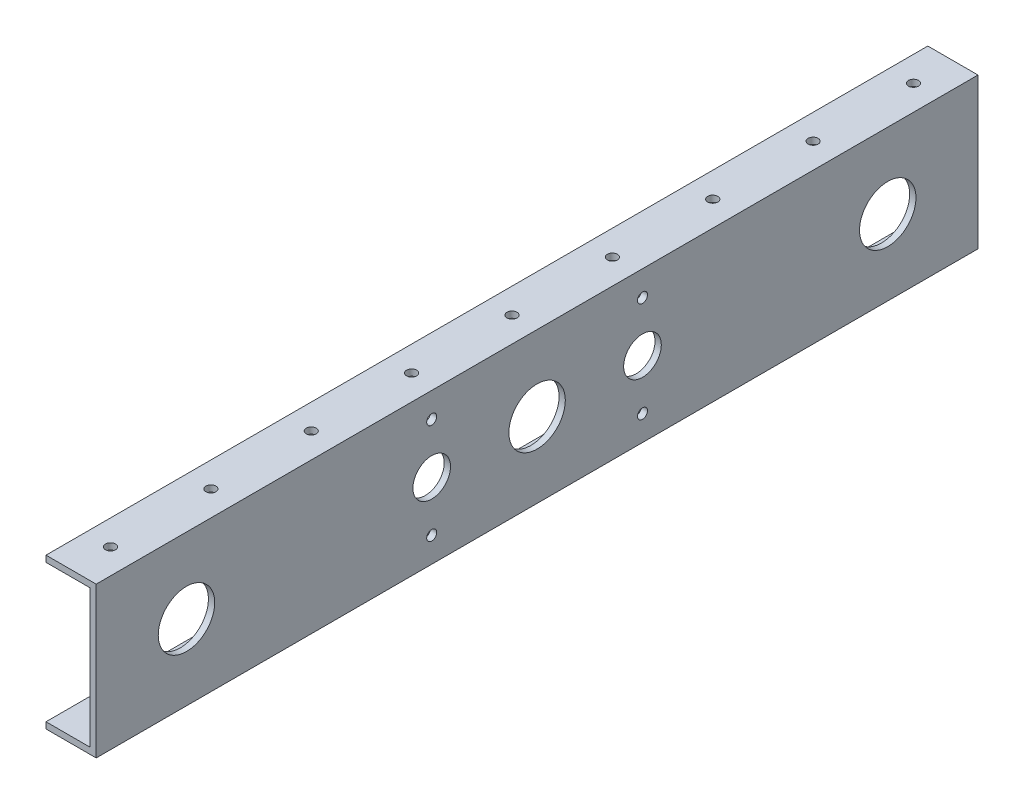
from build123d import *

# Parameters (mm, degrees)
BOSS_EXTRUDE1_START = -317.5
SKETCH4_R           = 2.54
SKETCH4_R_2         = 9.525
SKETCH4_R_3         = 14.2875
BOSS_EXTRUDE1_DEPTH = 3.175
BOSS_EXTRUDE2_DEPTH = 3.175
BOSS_EXTRUDE3_START = -76.2
BOSS_EXTRUDE3_DEPTH = 3.175
SKETCH9_R           = 2.54
CUT_EXTRUDE2_DEPTH  = 506.024067921
LPATTERN1_COUNT     = 10
LPATTERN1_PITCH     = 50.8
SKETCH13_W          = 25.4
SKETCH13_H          = 139.7
CUT_EXTRUDE4_DEPTH  = 506.024067921


with BuildPart() as part:
    # Sketch4 → Boss-Extrude1 (new body)
    with BuildSketch(Plane(origin=(0, 0, 0), x_dir=(0, 0, -1), z_dir=(1, 0, 0)).offset(BOSS_EXTRUDE1_START)):
        with BuildLine():
            Line((362.853219884, 88.9), (0, 88.9))
            Line((0, 88.9), (0, 65.0875))
            ThreePointArc((0, 65.0875), (14.2875, 50.8), (0, 36.5125))
            Line((0, 36.5125), (0, 12.7))
            Line((0, 12.7), (362.853219884, 12.7))
            Line((362.853219884, 12.7), (362.853219884, 88.9))
        make_face()
        with Locations((53.34, 25.4)):
            Circle(SKETCH4_R, mode=Mode.SUBTRACT)
        with Locations((53.34, 50.8)):
            Circle(SKETCH4_R_2, mode=Mode.SUBTRACT)
        with Locations((177.45964, 50.8)):
            Circle(SKETCH4_R_3, mode=Mode.SUBTRACT)
        with Locations((53.34, 76.2)):
            Circle(SKETCH4_R, mode=Mode.SUBTRACT)
        with Locations((337.453219884, 53.975)):
            Circle(SKETCH4_R_3, mode=Mode.SUBTRACT)
    extrude(amount=-BOSS_EXTRUDE1_DEPTH)

    # Sketch7 → Boss-Extrude2 (add)
    with BuildSketch(Plane(origin=(0, 88.9, 0), x_dir=(1, 0, 0), z_dir=(0, 1, 0))):
        Polygon((-319.0875, 0), (-342.9, 0), (-342.9, 362.853219884), (-317.5, 362.853219884), align=None)
    extrude(amount=-BOSS_EXTRUDE2_DEPTH)

    # Sketch7<2> → Boss-Extrude3 (add)
    with BuildSketch(Plane(origin=(0, 88.9, 0), x_dir=(1, 0, 0), z_dir=(0, 1, 0)).offset(BOSS_EXTRUDE3_START)):
        Polygon((-319.0875, 0), (-342.9, 0), (-342.9, 362.853219884), (-317.5, 362.853219884), align=None)
    extrude(amount=BOSS_EXTRUDE3_DEPTH)

    # Sketch9 → Cut-Extrude2 (cut, through all)
    with BuildSketch(Plane(origin=(0, 88.9, 0), x_dir=(1, 0, 0), z_dir=(0, 1, 0))):
        with Locations(Location((-330.2, 355.6, 0), (0, 0, 270))):
            Circle(SKETCH9_R)
    cut_extrude2 = extrude(amount=-CUT_EXTRUDE2_DEPTH, mode=Mode.SUBTRACT)

    # LPattern1: Cut-Extrude2 ×10
    with Locations(*[(0, 0, i * LPATTERN1_PITCH) for i in range(1, LPATTERN1_COUNT)]):
        add(cut_extrude2, mode=Mode.SUBTRACT)

    # Mirror1: part across face


with BuildPart() as part_1:
    add(part.part)
    add(part.part.mirror(Plane(origin=(-320.239664948, 22.265914948, 0), x_dir=(1, 0, 0), z_dir=(0, 0, 1))))

    # Sketch13 → Cut-Extrude4 (cut, through all)
    with BuildSketch(Plane(origin=(0, 88.9, 0), x_dir=(1, 0, 0), z_dir=(0, 1, 0))):
        with Locations((-330.2, 293.003219884)):
            Rectangle(SKETCH13_W, SKETCH13_H)
        with Locations((-330.2, -293.003219884)):
            Rectangle(SKETCH13_W, SKETCH13_H)
    extrude(amount=-CUT_EXTRUDE4_DEPTH, mode=Mode.SUBTRACT)


solid = part_1.part
